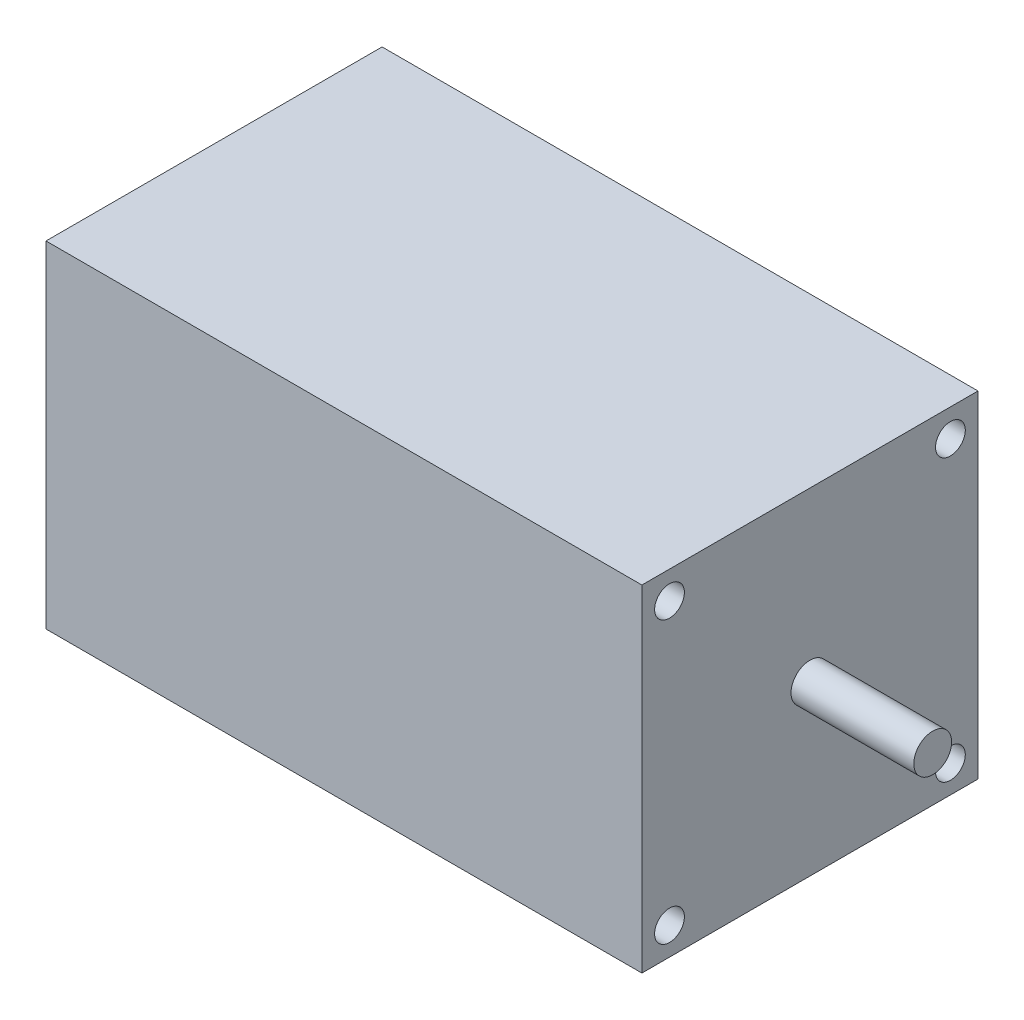
from build123d import *

# Parameters (mm, degrees)
SKETCH2_W           = 56.4
SKETCH2_H           = 56.4
BOSS_EXTRUDE1_DEPTH = 100
SKETCH3_R           = 2.5
CUT_EXTRUDE1_DEPTH  = 100
SKETCH4_R           = 3.175
BOSS_EXTRUDE2_DEPTH = 20.6


with BuildPart() as part:
    # Sketch2 → Boss-Extrude1 (new body)
    with BuildSketch(Plane(origin=(0, 0, 0), x_dir=(0, 0, -1), z_dir=(1, 0, 0))):
        Rectangle(SKETCH2_W, SKETCH2_H)
    extrude(amount=-BOSS_EXTRUDE1_DEPTH)

    # Sketch3 → Cut-Extrude1 (cut)
    with BuildSketch(Plane(origin=(0, 0, 0), x_dir=(0, 0, -1), z_dir=(1, 0, 0))):
        with Locations((-23.57, 23.57)):
            Circle(SKETCH3_R)
        with Locations(Location((23.57, 23.57, 0), (0, 0, 180))):
            Circle(SKETCH3_R)
        with Locations((23.57, -23.57)):
            Circle(SKETCH3_R)
        with Locations(Location((-23.57, -23.57, 0), (0, 0, 180))):
            Circle(SKETCH3_R)
    extrude(amount=-CUT_EXTRUDE1_DEPTH, mode=Mode.SUBTRACT)

    # Sketch4 → Boss-Extrude2 (add)
    with BuildSketch(Plane(origin=(0, 0, 0), x_dir=(0, 0, -1), z_dir=(1, 0, 0))):
        with Locations(Location((0, 0, 0), (0, 0, 180))):
            Circle(SKETCH4_R)
    extrude(amount=BOSS_EXTRUDE2_DEPTH)


solid = part.part
